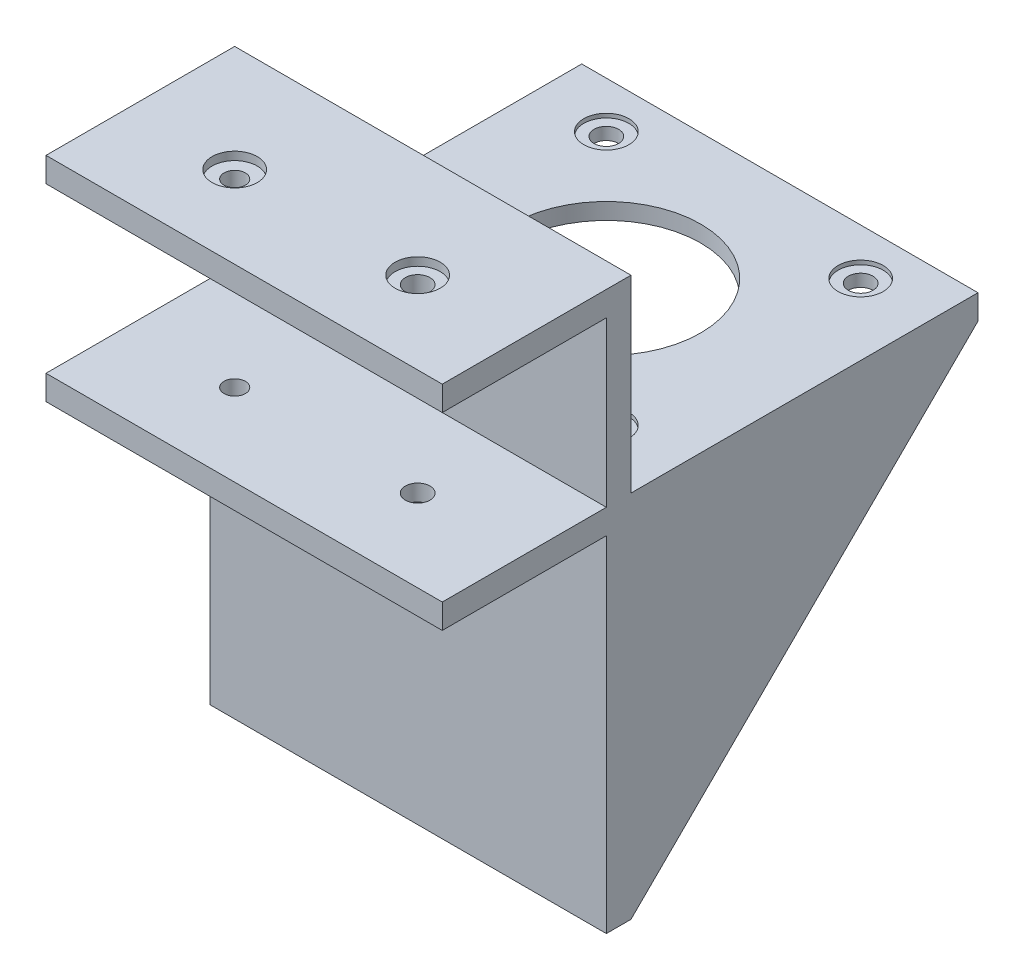
from build123d import *

# Parameters (mm, degrees)
SKETCH1_W                = 42.3
SKETCH1_H                = 42.3
SKETCH1_R                = 11.5
BOSS_EXTRUDE2_DEPTH      = 3
SKETCH2_R                = 1.5
CUT_EXTRUDE1_DEPTH       = 3
BOSS_EXTRUDE3_DEPTH      = 3
BOSS_EXTRUDE3_DEPTH_BACK = 42
SKETCH3_W                = 3
SKETCH3_H                = 42.3
SKETCH5_W                = 45.3
SKETCH5_H                = 45
BOSS_EXTRUDE4_DEPTH      = 3
CUT_EXTRUDE3_DEPTH       = 74.092954517
CUT_EXTRUDE3_DEPTH_BACK  = 3
SKETCH8_W                = 45.3
SKETCH8_H                = 45
BOSS_EXTRUDE5_DEPTH      = 3
SKETCH12_W               = 48.3
SKETCH12_H               = 3
BOSS_EXTRUDE6_DEPTH      = 23
SKETCH14_W               = 48.3
SKETCH14_H               = 3
BOSS_EXTRUDE7_DEPTH      = 20
SKETCH17_R               = 2.75
CUT_EXTRUDE5_DEPTH       = 0.5
CUT_EXTRUDE6_DEPTH       = 75.869085743
CUT_EXTRUDE6_DEPTH_BACK  = 3
SKETCH19_W               = 48.3
SKETCH19_H               = 3
BOSS_EXTRUDE8_DEPTH      = 20
SKETCH21_R               = 1.5
CUT_EXTRUDE7_DEPTH       = 20
SKETCH23_R               = 2.75
CUT_EXTRUDE9_DEPTH       = 1
SKETCH26_R               = 2.75
CUT_EXTRUDE10_DEPTH      = 1
SKETCH27_R               = 1.3
SKETCH27_R_2             = 1.5
CUT_EXTRUDE11_DEPTH      = 41
SKETCH30_R               = 2.75
CUT_EXTRUDE12_DEPTH      = 1
SKETCH31_R               = 2.75
CUT_EXTRUDE13_DEPTH      = 1
CUT_EXTRUDE14_START      = -1
SKETCH32_R               = 2.75
CUT_EXTRUDE14_DEPTH      = 1
CUT_EXTRUDE15_START      = -1
SKETCH33_R               = 2.75
CUT_EXTRUDE15_DEPTH      = 1
SKETCH38_W               = 42.3
SKETCH38_H               = 42.3
CUT_EXTRUDE16_DEPTH      = 1


with BuildPart() as part:
    # Sketch1 → Boss-Extrude2 (new body)
    with BuildSketch(Plane(origin=(0, 0, 0), x_dir=(1, 0, 0), z_dir=(0, 1, 0))):
        with Locations((21.15, 21.15)):
            Rectangle(SKETCH1_W, SKETCH1_H)
        with Locations(Location((21.15, 21.15, 0), (0, 0, 270))):
            Circle(SKETCH1_R, mode=Mode.SUBTRACT)
    extrude(amount=BOSS_EXTRUDE2_DEPTH)

    # Sketch2 → Cut-Extrude1 (cut)
    with BuildSketch(Plane(origin=(0, 3, 0), x_dir=(1, 0, 0), z_dir=(0, 1, 0))):
        with Locations(Location((5.65, 5.65, 0), (0, 0, 270))):
            Circle(SKETCH2_R)
        with Locations(Location((5.65, 36.65, 0), (0, 0, 270))):
            Circle(SKETCH2_R)
        with Locations(Location((36.65, 36.65, 0), (0, 0, 270))):
            Circle(SKETCH2_R)
        with Locations(Location((36.65, 5.65, 0), (0, 0, 270))):
            Circle(SKETCH2_R)
    extrude(amount=-CUT_EXTRUDE1_DEPTH, mode=Mode.SUBTRACT)

    # Sketch3 → Boss-Extrude3 (add, two sides: drawn at the far end of the back side and taken through both)
    with BuildSketch(Plane(origin=(0, 0, 0), x_dir=(1, 0, 0), z_dir=(0, 1, 0)).offset(-BOSS_EXTRUDE3_DEPTH_BACK)):
        with Locations((-1.5, 21.15)):
            Rectangle(SKETCH3_W, SKETCH3_H)
    extrude(amount=BOSS_EXTRUDE3_DEPTH + BOSS_EXTRUDE3_DEPTH_BACK)

    # Sketch5 → Boss-Extrude4 (add)
    with BuildSketch(Plane.XY):
        with Locations((19.65, -19.5)):
            Rectangle(SKETCH5_W, SKETCH5_H)
    extrude(amount=BOSS_EXTRUDE4_DEPTH)

    # Sketch6 → Cut-Extrude3 (cut, two sides: drawn at the far end of the back side and taken through both)
    with BuildSketch(Plane(origin=(0, 0, 0), x_dir=(0, 0, -1), z_dir=(1, 0, 0)).offset(-CUT_EXTRUDE3_DEPTH_BACK)):
        Polygon((-94.768878565, -136.096758859), (0, -42), (42.3, 0), (137.068878565, 94.096758859), (325.262396283, -95.440998271), (93.424639153, -325.634515989), align=None)
    extrude(amount=CUT_EXTRUDE3_DEPTH + CUT_EXTRUDE3_DEPTH_BACK, mode=Mode.SUBTRACT)

    # Sketch8 → Boss-Extrude5 (add)
    with BuildSketch(Plane(origin=(42.3, 0, 0), x_dir=(0, 0, -1), z_dir=(1, 0, 0))):
        with Locations((19.65, -19.5)):
            Rectangle(SKETCH8_W, SKETCH8_H)
    extrude(amount=BOSS_EXTRUDE5_DEPTH)

    # Sketch12 → Boss-Extrude6 (add)
    with BuildSketch(Plane(origin=(0, 3, 0), x_dir=(1, 0, 0), z_dir=(0, 1, 0))):
        with Locations((21.15, -1.5)):
            Rectangle(SKETCH12_W, SKETCH12_H)
    extrude(amount=BOSS_EXTRUDE6_DEPTH)

    # Sketch14 → Boss-Extrude7 (add)
    with BuildSketch(Plane.XY.offset(3)):
        with Locations((21.15, 24.5)):
            Rectangle(SKETCH14_W, SKETCH14_H)
    extrude(amount=BOSS_EXTRUDE7_DEPTH)

    # Sketch17 → Cut-Extrude5 (cut)
    with BuildSketch(Plane(origin=(0, 3, 0), x_dir=(1, 0, 0), z_dir=(0, 1, 0))):
        with Locations(Location((36.65, 36.65, 0), (0, 0, 270))):
            Circle(SKETCH17_R)
        with Locations(Location((36.65, 5.65, 0), (0, 0, 270))):
            Circle(SKETCH17_R)
        with Locations(Location((5.65, 36.65, 0), (0, 0, 270))):
            Circle(SKETCH17_R)
        with Locations(Location((5.65, 5.65, 0), (0, 0, 270))):
            Circle(SKETCH17_R)
    extrude(amount=-CUT_EXTRUDE5_DEPTH, mode=Mode.SUBTRACT)

    # Sketch18 → Cut-Extrude6 (cut, two sides: drawn at the far end of the back side and taken through both)
    with BuildSketch(Plane.ZY.offset(-42.3).offset(-CUT_EXTRUDE6_DEPTH_BACK)):
        Polygon((-163.053000202, 119.896595945), (-42.3, 0), (0, -42), (120.753000202, -161.896595945), (-119.040191688, -403.402596349), (-402.846192092, -121.609404459), align=None)
    extrude(amount=CUT_EXTRUDE6_DEPTH + CUT_EXTRUDE6_DEPTH_BACK, mode=Mode.SUBTRACT)

    # Sketch19 → Boss-Extrude8 (add)
    with BuildSketch(Plane.XY.offset(3)):
        with Locations((21.15, 1.5)):
            Rectangle(SKETCH19_W, SKETCH19_H)
    extrude(amount=BOSS_EXTRUDE8_DEPTH)

    # Sketch21 → Cut-Extrude7 (cut)
    with BuildSketch(Plane(origin=(0, 0, 0), x_dir=(-1, 0, 0), z_dir=(0, 0, -1))):
        with Locations((-32.301370807, 13)):
            Circle(SKETCH21_R)
        with Locations((-10, 13)):
            Circle(SKETCH21_R)
    extrude(amount=-CUT_EXTRUDE7_DEPTH, mode=Mode.SUBTRACT)

    # Sketch23 → Cut-Extrude9 (cut)
    with BuildSketch(Plane(origin=(0, 0, 0), x_dir=(-1, 0, 0), z_dir=(0, 0, -1))):
        with Locations((-10, 13)):
            Circle(SKETCH23_R)
    extrude(amount=-CUT_EXTRUDE9_DEPTH, mode=Mode.SUBTRACT)

    # Sketch26 → Cut-Extrude10 (cut)
    with BuildSketch(Plane(origin=(0, 0, 0), x_dir=(-1, 0, 0), z_dir=(0, 0, -1))):
        with Locations((-32.3, 13)):
            Circle(SKETCH26_R)
    extrude(amount=-CUT_EXTRUDE10_DEPTH, mode=Mode.SUBTRACT)

    # Sketch27 → Cut-Extrude11 (cut)
    with BuildSketch(Plane(origin=(0, 26, 0), x_dir=(1, 0, 0), z_dir=(0, 1, 0))):
        with Locations(Location((10, -13, 0), (0, 0, 270))):
            Circle(SKETCH27_R)
        with Locations(Location((32.3, -13, 0), (0, 0, 270))):
            Circle(SKETCH27_R_2)
    extrude(amount=-CUT_EXTRUDE11_DEPTH, mode=Mode.SUBTRACT)

    # Sketch30 → Cut-Extrude12 (cut)
    with BuildSketch(Plane(origin=(0, 26, 0), x_dir=(1, 0, 0), z_dir=(0, 1, 0))):
        with Locations(Location((10, -13, 0), (0, 0, 270))):
            Circle(SKETCH30_R)
    extrude(amount=-CUT_EXTRUDE12_DEPTH, mode=Mode.SUBTRACT)

    # Sketch31 → Cut-Extrude13 (cut)
    with BuildSketch(Plane(origin=(0, 26, 0), x_dir=(1, 0, 0), z_dir=(0, 1, 0))):
        with Locations(Location((32.3, -13, 0), (0, 0, 270))):
            Circle(SKETCH31_R)
    extrude(amount=-CUT_EXTRUDE13_DEPTH, mode=Mode.SUBTRACT)

    # Sketch32 → Cut-Extrude14 (cut)
    with BuildSketch(Plane.XZ.offset(CUT_EXTRUDE14_START)):
        with Locations(Location((32.3, 13, 0), (0, 0, 90))):
            Circle(SKETCH32_R)
    extrude(amount=CUT_EXTRUDE14_DEPTH, mode=Mode.SUBTRACT)

    # Sketch33 → Cut-Extrude15 (cut)
    with BuildSketch(Plane.XZ.offset(CUT_EXTRUDE15_START)):
        with Locations(Location((10, 13, 0), (0, 0, 90))):
            Circle(SKETCH33_R)
    extrude(amount=CUT_EXTRUDE15_DEPTH, mode=Mode.SUBTRACT)

    # Sketch38 → Cut-Extrude16 (cut)
    with BuildSketch(Plane(origin=(0, 0, 0), x_dir=(-1, 0, 0), z_dir=(0, -1, 0))):
        with Locations((-21.15, 21.15)):
            Rectangle(SKETCH38_W, SKETCH38_H)
    extrude(amount=-CUT_EXTRUDE16_DEPTH, mode=Mode.SUBTRACT)


solid = part.part
